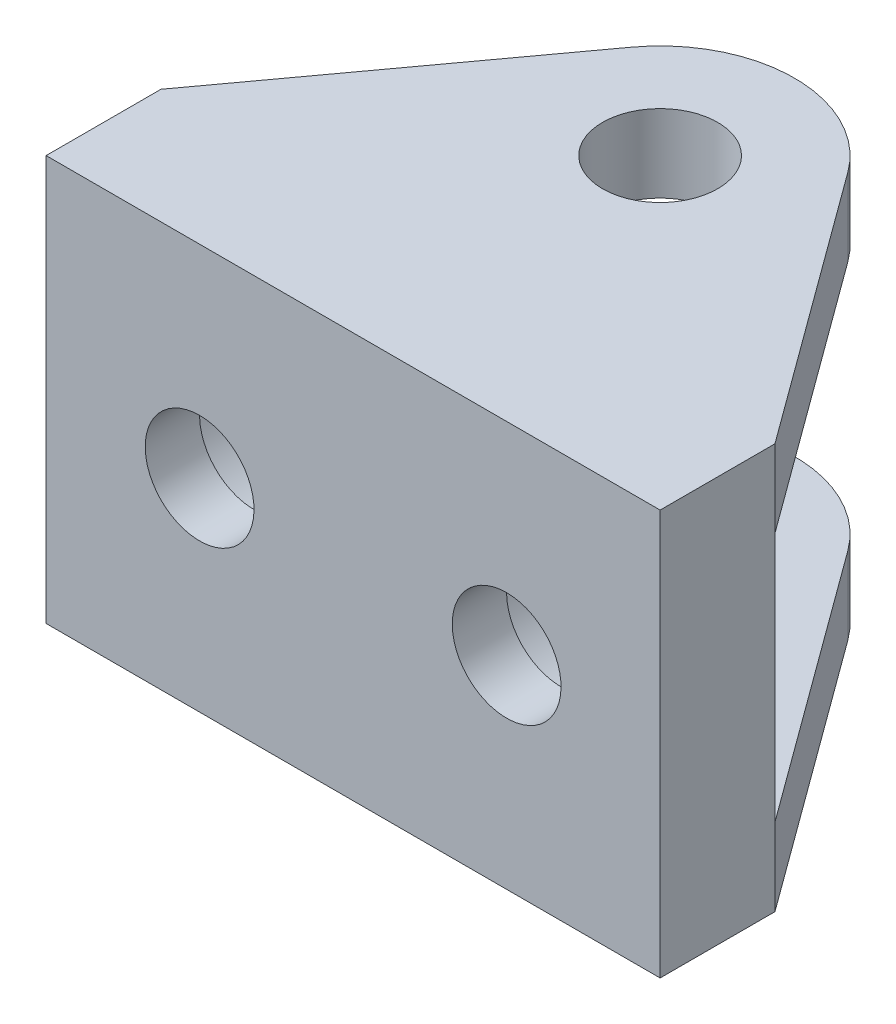
from build123d import *

# Parameters (mm, degrees)
SKETCH1_R                               = 4.7625
BOSS_EXTRUDE1_DEPTH                     = 33.528
CUT_EXTRUDE1_DEPTH                      = 71.978373046
CBORE_FOR_M8_HEX_HEAD_BOLT1_D           = 9
CBORE_FOR_M8_HEX_HEAD_BOLT1_CBORE_D     = 16
CBORE_FOR_M8_HEX_HEAD_BOLT1_CBORE_DEPTH = 5


with BuildPart() as part:
    # Sketch1 → Boss-Extrude1 (new body)
    with BuildSketch(Plane(origin=(0, 0, 0), x_dir=(1, 0, 0), z_dir=(0, 1, 0))):
        with BuildLine():
            Line((0, 0), (50.8, 0))
            Line((50.8, 0), (50.8, 9.4996))
            Line((50.8, 9.4996), (34.368896597, 31.960986975))
            ThreePointArc((34.368896597, 31.960986975), (25.4, 36.5125), (16.431103403, 31.960986975))
            Line((16.431103403, 31.960986975), (0, 9.4996))
            Line((0, 9.4996), (0, 0))
        make_face()
        with Locations(Location((25.4, 25.4, 0), (0, 0, 270))):
            Circle(SKETCH1_R, mode=Mode.SUBTRACT)
    extrude(amount=BOSS_EXTRUDE1_DEPTH)

    # Sketch2 → Cut-Extrude1 (cut, through all)
    with BuildSketch(Plane(origin=(50.8, 0, 0), x_dir=(0, 0, -1), z_dir=(1, 0, 0))):
        Polygon((9.4996, 16.764), (9.4996, 27.1145), (36.5125, 27.1145), (36.5125, 6.4135), (9.4996, 6.4135), align=None)
    extrude(amount=-CUT_EXTRUDE1_DEPTH, mode=Mode.SUBTRACT)

    # CBORE for M8 Hex Head Bolt1 (through all)
    with Locations(Plane(origin=(0, 0, -9.4996), x_dir=(-1, 0, 0), z_dir=(0, 0, -1))):
        with Locations((-12.7, 16.764), (-38.1, 16.764)):
            CounterBoreHole(CBORE_FOR_M8_HEX_HEAD_BOLT1_D / 2, CBORE_FOR_M8_HEX_HEAD_BOLT1_CBORE_D / 2, CBORE_FOR_M8_HEX_HEAD_BOLT1_CBORE_DEPTH)


solid = part.part
